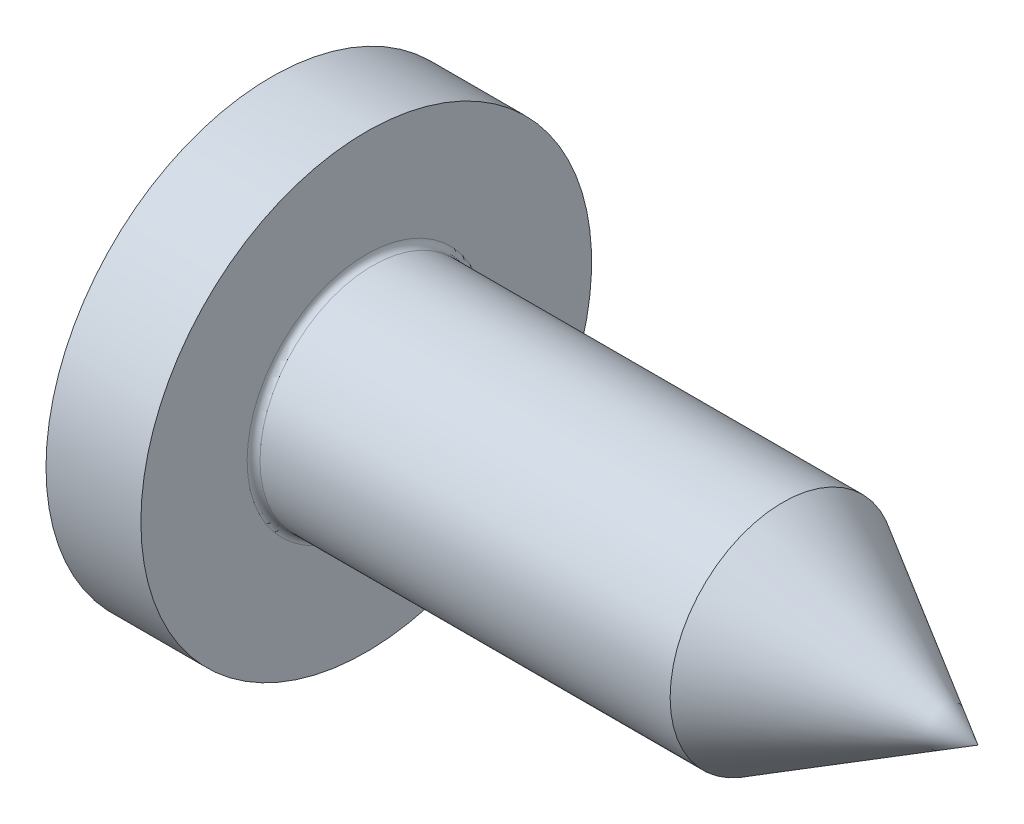
from build123d import *

# Parameters (mm, degrees)
CHAMFER1_SIZE      = 0.35
CHAMFER1_SIZE2     = 0.606217783
CUT_EXTRUDE1_DEPTH = 1.4
CUT_EXTRUDE1_TAPER = 6
FILLET1_R          = 0.1


with BuildPart() as part:
    # Sketch1 → Revolve1 (revolve)
    with BuildSketch(Plane.XY, mode=Mode.PRIVATE) as revolve1_sk:
        with BuildLine():
            Line((0, 3.5), (-1.473397172, 3.5))
            ThreePointArc((-1.473397172, 3.5), (-2.311408891, 1.838425545), (-2.6, 0))
            Line((-2.6, 0), (9.5, 0))
            Line((9.5, 0), (9.5, 1.75))
            Line((9.5, 1.75), (0, 1.75))
            Line((0, 1.75), (0, 3.5))
        make_face()
    revolve(revolve1_sk.sketch.rotate(Axis((0, 0, 0), (1, 0, 0)), 90), axis=Axis((0, 0, 0), (1, 0, 0)))

    # Chamfer1
    chamfer1_edges = [part.edges().sort_by_distance(p)[0] for p in [
        (9.5, 0, -1.75),
    ]]
    chamfer1_side = [part.faces().sort_by_distance(p)[0] for p in [
        (9.5, 0, 0),
    ]]
    chamfer(chamfer1_edges, length=CHAMFER1_SIZE, length2=CHAMFER1_SIZE2, reference=chamfer1_side[0])

    # Sketch2 → EndCone (revolve, cut)
    with BuildSketch(Plane.XY, mode=Mode.PRIVATE) as endcone_sk:
        Polygon((9.5, 0), (6.468911087, 1.75), (6.468911087, 1.85), (9.6, 1.85), (9.6, 0), align=None)
    revolve(endcone_sk.sketch.rotate(Axis((0, 0, 0), (1, 0, 0)), 90), axis=Axis((0, 0, 0), (1, 0, 0)), mode=Mode.SUBTRACT)

    # Sketch3 → Cut-Extrude1 (cut)
    with BuildSketch(Plane(origin=(-2.6, 0, 0), x_dir=(0, 0, -1), z_dir=(1, 0, 0))):
        Polygon((-0.4875, 1.95), (-0.2925, 1.17), (-0.613687292, 0.613687292), (-1.17, 0.2925), (-1.95, 0.4875), (-1.95, -0.4875), (-1.17, -0.2925), (-0.613687292, -0.613687292), (-0.2925, -1.17), (-0.4875, -1.95), (0.4875, -1.95), (0.2925, -1.17), (0.613687292, -0.613687292), (1.17, -0.2925), (1.95, -0.4875), (1.95, 0.4875), (1.17, 0.2925), (0.613687292, 0.613687292), (0.2925, 1.17), (0.4875, 1.95), align=None)
    extrude(amount=CUT_EXTRUDE1_DEPTH, taper=CUT_EXTRUDE1_TAPER, mode=Mode.SUBTRACT)

    # Fillet1
    fillet1_edges = [part.edges().sort_by_distance(p)[0] for p in [
        (0, 0, -1.75),
    ]]
    fillet(fillet1_edges, radius=FILLET1_R)


solid = part.part
